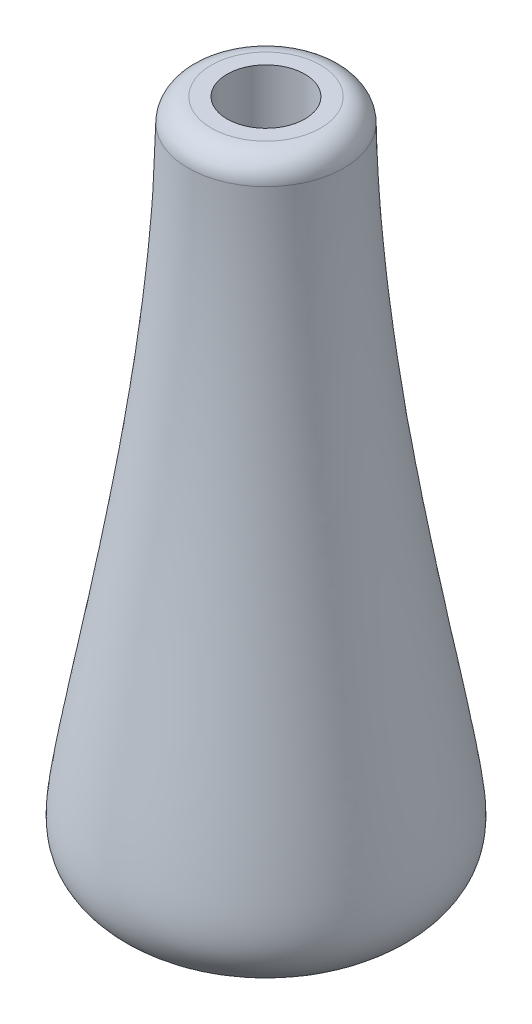
from build123d import *

# Parameters (mm, degrees)
SKETCH2_R          = 5
CUT_EXTRUDE2_DEPTH = 70
FILLET1_R          = 3


with BuildPart() as part:
    # Sketch1 → Revolve1 (revolve)
    with BuildSketch(Plane(origin=(0, 0, 0), x_dir=(0, 0, -1), z_dir=(1, 0, 0))):
        with BuildLine():
            Line((0, 0), (0, 90))
            Line((0, 90), (10, 90))
            add(Edge.make_bspline(
                [(10, 90), (10, 60), (18.819759302, 22.8052024), (20.928757216, 2.414876553), (9, 0), (0, 0)],
                knots=[0, 0, 0, 0, 0.550031467, 0.650031467, 1, 1, 1, 1], degree=3))
        make_face()
    revolve(axis=Axis((0, 0, 0), (0, 1, 0)))

    # Sketch2 → Cut-Extrude2 (cut)
    with BuildSketch(Plane(origin=(0, 90, 0), x_dir=(1, 0, 0), z_dir=(0, 1, 0))):
        with Locations(Location((0, 0, 0), (0, 0, 270))):
            Circle(SKETCH2_R)
    extrude(amount=-CUT_EXTRUDE2_DEPTH, mode=Mode.SUBTRACT)

    # Fillet1
    fillet1_edges = [part.edges().sort_by_distance(p)[0] for p in [
        (0, 90, 10),
    ]]
    fillet(fillet1_edges, radius=FILLET1_R)


solid = part.part
